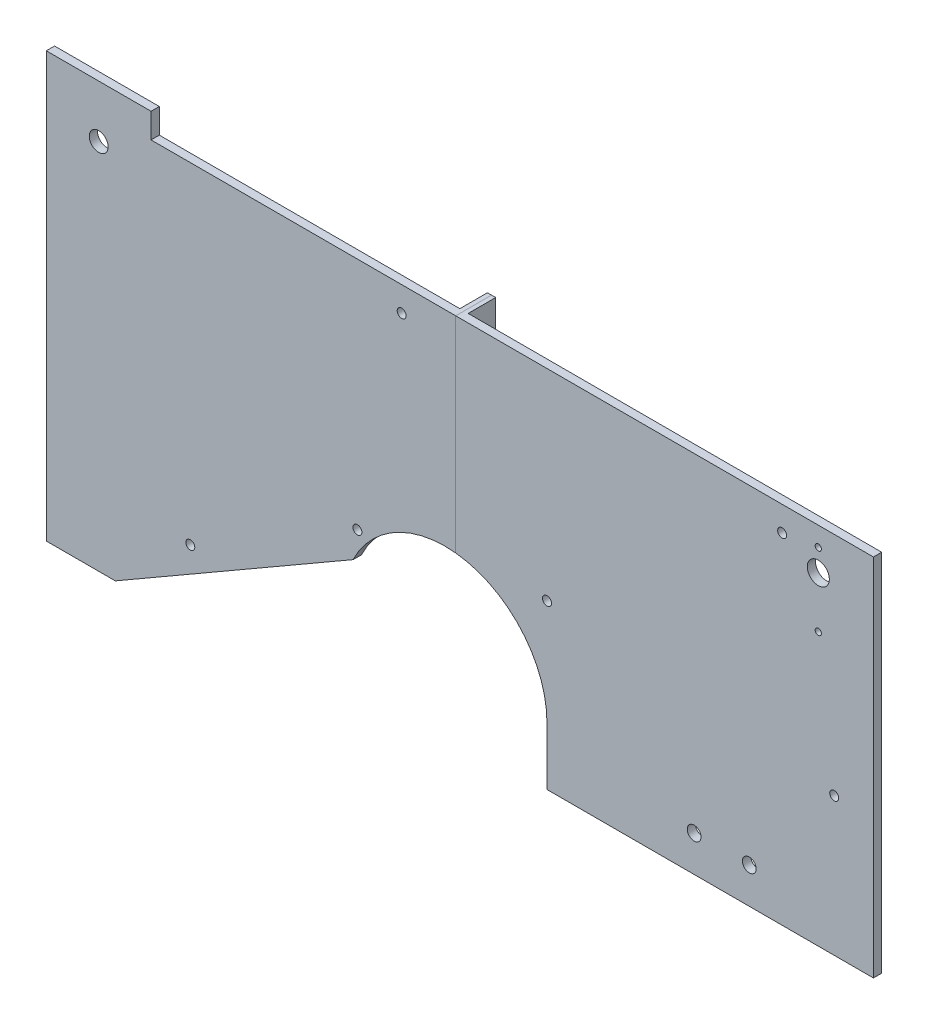
from build123d import *

# Parameters (mm, degrees)
SKETCH2_R              = 3.425
BOSS_EXTRUDE2_DEPTH    = 3
SKETCH3_W              = 118.4
SKETCH3_H              = 12.75
CUT_EXTRUDE1_DEPTH     = 338.231374578
SKETCH5_R              = 2.5
SKETCH5_R_2            = 4
SKETCH5_R_3            = 1.125
SKETCH5_R_4            = 1.625
CUT_EXTRUDE2_DEPTH     = 338.231374578
SKETCH12_W             = 3
SKETCH12_H             = 70
BOSS_EXTRUDE6_DEPTH    = 10
CUT_EXTRUDE5_REACH     = 217.212
SKETCH15_R             = 1.625
SPLIT4_SURFACE_1_BACK  = 338.469
SPLIT4_SURFACE_1_DEPTH = 676.938
SPLIT4_SURFACE_2_BACK  = 338.469
SPLIT4_SURFACE_2_DEPTH = 676.938


with BuildPart() as part:
    # Sketch2 → Boss-Extrude2 (new body)
    with BuildSketch(Plane.XY):
        with BuildLine():
            Line((25.03035901, 0), (111.286489227, 49.8))
            ThreePointArc((111.286489227, 49.8), (152.858332199, 69.766604349), (181.6, 33.7))
            Line((181.6, 33.7), (181.6, 0))
            Line((181.6, 0), (300, 0))
            Line((300, 0), (300, 145))
            Line((300, 145), (38, 145))
            Line((38, 145), (38, 154))
            Line((38, 154), (19, 154))
            Line((19, 154), (0, 154))
            Line((0, 154), (0, 0))
            Line((0, 0), (25.03035901, 0))
        make_face()
        with Locations((19, 135)):
            Circle(SKETCH2_R, mode=Mode.SUBTRACT)
    extrude(amount=BOSS_EXTRUDE2_DEPTH)

    # Sketch3 → Cut-Extrude1 (cut, through all)
    with BuildSketch(Plane.XY.offset(3)):
        with Locations((240.8, 6.375)):
            Rectangle(SKETCH3_W, SKETCH3_H)
    extrude(amount=-CUT_EXTRUDE1_DEPTH, mode=Mode.SUBTRACT)

    # Sketch5 → Cut-Extrude2 (cut, through all)
    with BuildSketch(Plane.XY.offset(3)):
        with Locations((254.98, 25.75)):
            Circle(SKETCH5_R)
        with Locations((234.98, 25.75)):
            Circle(SKETCH5_R)
        with Locations((280, 130)):
            Circle(SKETCH5_R_2)
        with Locations((280, 138)):
            Circle(SKETCH5_R_3)
        with Locations((280, 111.5)):
            Circle(SKETCH5_R_3)
        with Locations((181.6, 72.03)):
            Circle(SKETCH5_R_4)
        with Locations((285.78, 62.92)):
            Circle(SKETCH5_R_4)
        with Locations((52.23, 24.91)):
            Circle(SKETCH5_R_4)
        with Locations((112.84, 59.93)):
            Circle(SKETCH5_R_4)
        with Locations((266.89, 135.99)):
            Circle(SKETCH5_R_4)
        with Locations((128.89, 135.99)):
            Circle(SKETCH5_R_4)
    extrude(amount=-CUT_EXTRUDE2_DEPTH, mode=Mode.SUBTRACT)

    # Sketch12 → Boss-Extrude6 (add)
    with BuildSketch(Plane(origin=(0, 0, 0), x_dir=(-1, 0, 0), z_dir=(0, 0, -1))):
        with Locations((-148.5, 110)):
            Rectangle(SKETCH12_W, SKETCH12_H)
    extrude(amount=BOSS_EXTRUDE6_DEPTH)

    # Sketch15 → Cut-Extrude5 (cut, up to next)
    with BuildSketch(Plane(origin=(150, 0, 0), x_dir=(0, 0, -1), z_dir=(1, 0, 0)), mode=Mode.PRIVATE) as cut_extrude5_sk1:
        with Locations((5, 135)):
            Circle(SKETCH15_R)
    cut_extrude5_tool1 = extrude(cut_extrude5_sk1.sketch, amount=-CUT_EXTRUDE5_REACH, mode=Mode.PRIVATE) & part.part
    # Sketch15 → Cut-Extrude5 (cut, up to next)
    with BuildSketch(Plane(origin=(150, 0, 0), x_dir=(0, 0, -1), z_dir=(1, 0, 0)), mode=Mode.PRIVATE) as cut_extrude5_sk2:
        with Locations((5, 110)):
            Circle(SKETCH15_R)
    cut_extrude5_tool2 = extrude(cut_extrude5_sk2.sketch, amount=-CUT_EXTRUDE5_REACH, mode=Mode.PRIVATE) & part.part
    # Sketch15 → Cut-Extrude5 (cut, up to next)
    with BuildSketch(Plane(origin=(150, 0, 0), x_dir=(0, 0, -1), z_dir=(1, 0, 0)), mode=Mode.PRIVATE) as cut_extrude5_sk3:
        with Locations((5, 85)):
            Circle(SKETCH15_R)
    cut_extrude5_tool3 = extrude(cut_extrude5_sk3.sketch, amount=-CUT_EXTRUDE5_REACH, mode=Mode.PRIVATE) & part.part
    add(cut_extrude5_tool1.solids().sort_by_distance((150, 135, -5))[0], mode=Mode.SUBTRACT)
    add(cut_extrude5_tool2.solids().sort_by_distance((150, 110, -5))[0], mode=Mode.SUBTRACT)
    add(cut_extrude5_tool3.solids().sort_by_distance((150, 85, -5))[0], mode=Mode.SUBTRACT)


with BuildPart() as body_2:
    # Split4: the piece behind the surface
    add(part.part)
    # Split4 surface: a surface, the sketch's curves swept straight by 676.938 mm
    with BuildLine(Plane(origin=(0, 0, -10), x_dir=(-1, 0, 0), z_dir=(0, 0, -1)).offset(-SPLIT4_SURFACE_1_BACK), mode=Mode.PRIVATE) as split4_surface_1_path:
        Line((-148.5, 145), (-148.5, 70.493885362))
    split4_surface_1 = Shell.extrude(split4_surface_1_path.wire(), (0 * SPLIT4_SURFACE_1_DEPTH, 0 * SPLIT4_SURFACE_1_DEPTH, -1 * SPLIT4_SURFACE_1_DEPTH))
    split(bisect_by=split4_surface_1, keep=Keep.BOTTOM)


with BuildPart() as part_1:
    add(part.part)

    # Split4: split by a surface, the side it looks to stays
    # Split4 surface: a surface, the sketch's curves swept straight by 676.938 mm
    with BuildLine(Plane(origin=(0, 0, -10), x_dir=(-1, 0, 0), z_dir=(0, 0, -1)).offset(-SPLIT4_SURFACE_2_BACK), mode=Mode.PRIVATE) as split4_surface_2_path:
        Line((-148.5, 145), (-148.5, 70.493885362))
    split4_surface_2 = Shell.extrude(split4_surface_2_path.wire(), (0 * SPLIT4_SURFACE_2_DEPTH, 0 * SPLIT4_SURFACE_2_DEPTH, -1 * SPLIT4_SURFACE_2_DEPTH))
    split(bisect_by=split4_surface_2, keep=Keep.TOP)


solid = Compound([body_2.part, part_1.part])
